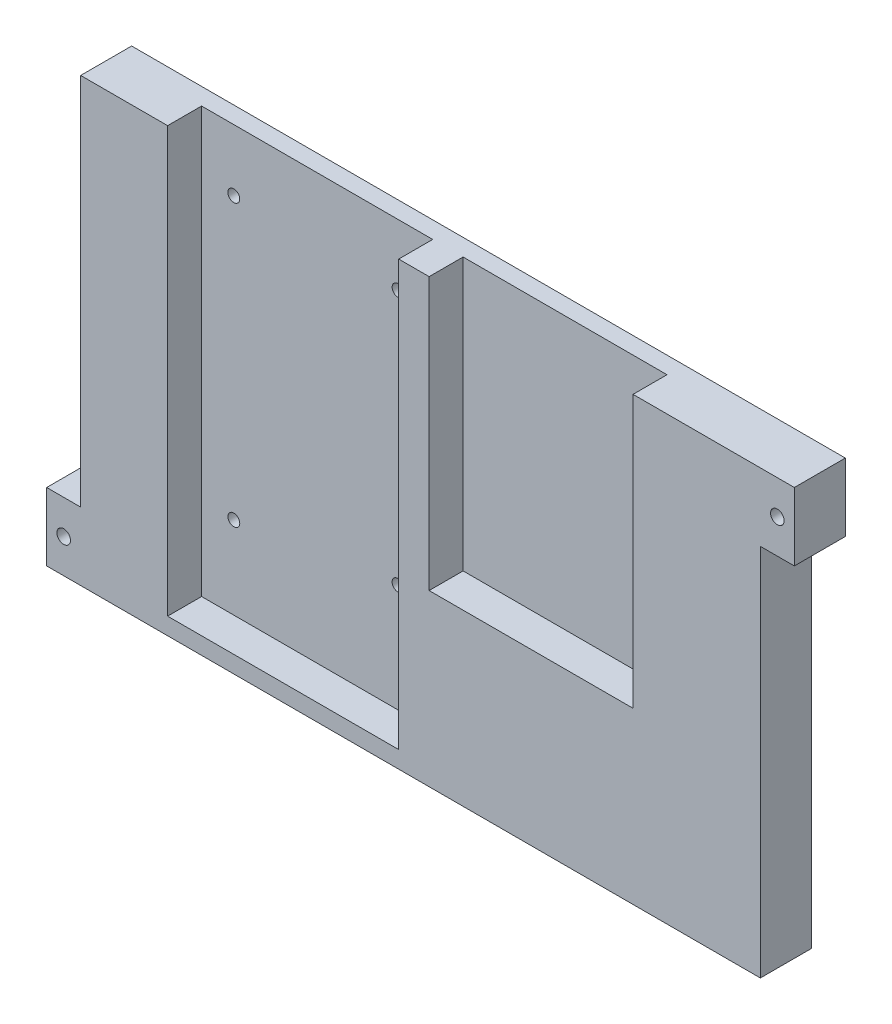
from build123d import *

# Parameters (mm, degrees)
SKETCH1_W                = 200
SKETCH1_H                = 130
BOSS_EXTRUDE1_DEPTH      = 15
SKETCH2_W                = 68
SKETCH2_H                = 125
SKETCH2_W_2              = 60
SKETCH2_H_2              = 80
CUT_EXTRUDE1_DEPTH       = 10
SKETCH6_R                = 1.75
CUT_EXTRUDE10_DEPTH      = 15
SKETCH7_W                = 15
SKETCH7_H                = 20
BOSS_EXTRUDE2_DEPTH      = 10
SKETCH8_W                = 15
SKETCH8_H                = 20
BOSS_EXTRUDE3_DEPTH      = 10
CUT_EXTRUDE11_DEPTH      = 40
CUT_EXTRUDE11_DEPTH_BACK = 40
SKETCH9_R                = 2


with BuildPart() as part:
    # Sketch1 → Boss-Extrude1 (new body)
    with BuildSketch(Plane.XY):
        with Locations((100, 65)):
            Rectangle(SKETCH1_W, SKETCH1_H)
    extrude(amount=BOSS_EXTRUDE1_DEPTH)

    # Sketch2 → Cut-Extrude1 (cut)
    with BuildSketch(Plane.XY.offset(15)):
        with Locations((59.584038162, 67.5)):
            Rectangle(SKETCH2_W, SKETCH2_H)
        with Locations((132.534942581, 90)):
            Rectangle(SKETCH2_W_2, SKETCH2_H_2)
    extrude(amount=-CUT_EXTRUDE1_DEPTH, mode=Mode.SUBTRACT)

    # Sketch6 → Cut-Extrude10 (cut)
    with BuildSketch(Plane.XY.offset(15)):
        with Locations((35.063099212, 111.894617683)):
            Circle(SKETCH6_R)
        with Locations((83.399299212, 111.894617683)):
            Circle(SKETCH6_R)
        with Locations((83.399299212, 36.761417683)):
            Circle(SKETCH6_R)
        with Locations((35.063099212, 29.268417683)):
            Circle(SKETCH6_R)
    extrude(amount=-CUT_EXTRUDE10_DEPTH, mode=Mode.SUBTRACT)

    # Sketch7 → Boss-Extrude2 (add)
    with BuildSketch(Plane(origin=(200, 0, 0), x_dir=(0, 0, -1), z_dir=(1, 0, 0))):
        with Locations((-7.5, 120)):
            Rectangle(SKETCH7_W, SKETCH7_H)
    extrude(amount=BOSS_EXTRUDE2_DEPTH)

    # Sketch8 → Boss-Extrude3 (add)
    with BuildSketch(Plane.ZY):
        with Locations((7.5, 10)):
            Rectangle(SKETCH8_W, SKETCH8_H)
    extrude(amount=BOSS_EXTRUDE3_DEPTH)

    # Sketch9 → Cut-Extrude11 (cut, two sides: drawn at the far end of the back side and taken through both)
    with BuildSketch(Plane.XY.offset(15).offset(-CUT_EXTRUDE11_DEPTH_BACK)):
        with Locations((-5, 10)):
            Circle(SKETCH9_R)
        with Locations((205, 120)):
            Circle(SKETCH9_R)
    extrude(amount=CUT_EXTRUDE11_DEPTH + CUT_EXTRUDE11_DEPTH_BACK, mode=Mode.SUBTRACT)


solid = part.part
